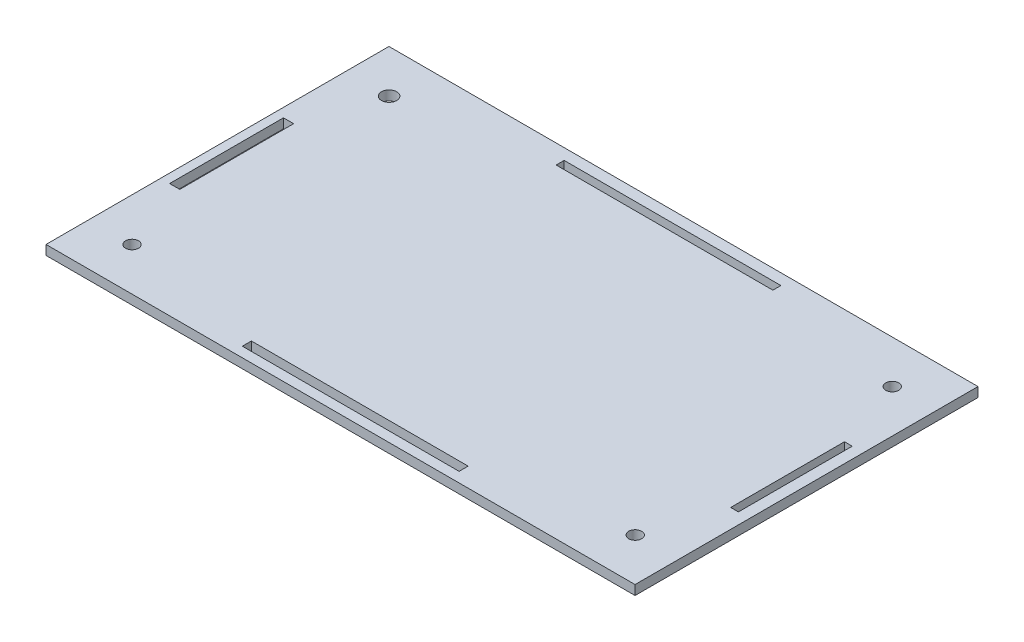
from build123d import *

# Parameters (mm, degrees)
SKETCH2_W           = 123.41
SKETCH2_H           = 71.848
SKETCH2_R           = 1.360904611
SKETCH2_R_2         = 1.6
SKETCH2_W_2         = 2.132357215
SKETCH2_H_2         = 23.848
SKETCH2_W_3         = 45.41
SKETCH2_H_3         = 1.677202247
SKETCH2_W_4         = 1.620785214
SKETCH2_H_4         = 1.892776038
BOSS_EXTRUDE1_DEPTH = 2


with BuildPart() as part:
    # Sketch2 → Boss-Extrude1 (new body)
    with BuildSketch(Plane(origin=(0, 0, 0), x_dir=(1, 0, 0), z_dir=(0, 1, 0))):
        with Locations((56.450952339, 30.702122774)):
            Rectangle(SKETCH2_W, SKETCH2_H)
        with Locations(Location((3.77654317, 3.778122774, 0), (0, 0, 270))):
            Circle(SKETCH2_R, mode=Mode.SUBTRACT)
        with Locations(Location((109.18654317, 3.778122774, 0), (0, 0, 270))):
            Circle(SKETCH2_R, mode=Mode.SUBTRACT)
        with Locations(Location((3.77654317, 57.626122774, 0), (0, 0, 270))):
            Circle(SKETCH2_R_2, mode=Mode.SUBTRACT)
        with Locations(Location((109.18654317, 57.626122774, 0), (0, 0, 270))):
            Circle(SKETCH2_R, mode=Mode.SUBTRACT)
        with Locations((-2.289635438, 30.702122774)):
            Rectangle(SKETCH2_W_2, SKETCH2_H_2, mode=Mode.SUBTRACT)
        with Locations((56.48154317, 63.464723898)):
            Rectangle(SKETCH2_W_3, SKETCH2_H_3, mode=Mode.SUBTRACT)
        with Locations((114.996935777, 30.702122774)):
            Rectangle(SKETCH2_W_4, SKETCH2_H_2, mode=Mode.SUBTRACT)
        with Locations((56.48154317, -2.168265245)):
            Rectangle(SKETCH2_W_3, SKETCH2_H_4, mode=Mode.SUBTRACT)
    extrude(amount=BOSS_EXTRUDE1_DEPTH)


solid = part.part
